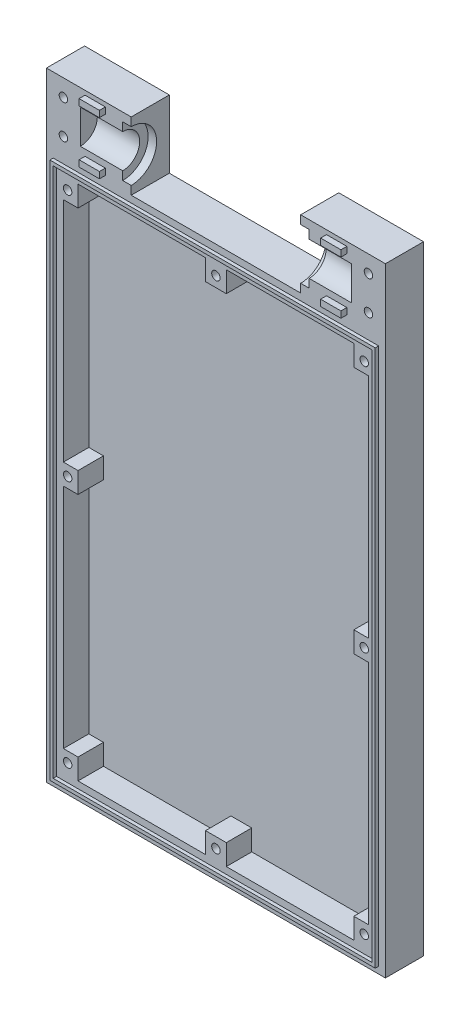
from build123d import *

# Parameters (mm, degrees)
IZIM1_R                       = 1
IZIM1_W                       = 4.8
IZIM1_H                       = 1.5
IZIM1_W_2                     = 76.8
IZIM1_H_2                     = 126.8
Y_KSEKLIK_EKSTR_ZYON1_DEPTH   = 9
IZIM1_W_3                     = 75.2
IZIM1_H_3                     = 125.2
Y_KSEKLIK_EKSTR_ZYON1_2_DEPTH = 9
IZIM1_3_W                     = 4.8
IZIM1_3_H                     = 1.5
Y_KSEKLIK_EKSTR_ZYON2_DEPTH   = 10.4
IZIM1_4_W                     = 76.8
IZIM1_4_H                     = 126.8
IZIM1_4_W_2                   = 75.2
IZIM1_4_H_2                   = 125.2
Y_KSEKLIK_EKSTR_ZYON3_DEPTH   = 9.8
Y_KSEKLIK_EKSTR_ZYON4_DEPTH   = 3
KES_EKSTR_ZYON1_DEPTH         = 52
KES_EKSTR_ZYON1_DEPTH_BACK    = 12
KES_EKSTR_ZYON2_DEPTH         = 42
KES_EKSTR_ZYON2_DEPTH_BACK    = 2


with BuildPart() as part:
    # Çizim1 → Yükseklik-Ekstrüzyon1 (new body)
    with BuildSketch(Plane.XY):
        Polygon((-33.05110417, 63.714698522), (-33.05110417, 79.714698522), (-53.05110417, 79.714698522), (-53.05110417, -66.285301478), (26.94889583, -66.285301478), (26.94889583, 79.714698522), (6.94889583, 79.714698522), (6.94889583, 63.714698522), align=None)
        with Locations((-49.05110417, 67.714698522)):
            Circle(IZIM1_R, mode=Mode.SUBTRACT)
        with Locations((-49.05110417, 75.714698522)):
            Circle(IZIM1_R, mode=Mode.SUBTRACT)
        with Locations((-41.55110417, 65.464698522)):
            Rectangle(IZIM1_W, IZIM1_H, mode=Mode.SUBTRACT)
        with Locations((-41.55110417, 77.964698522)):
            Rectangle(IZIM1_W, IZIM1_H, mode=Mode.SUBTRACT)
        with Locations((-13.05110417, -1.285301478)):
            Rectangle(IZIM1_W_2, IZIM1_H_2, mode=Mode.SUBTRACT)
        with Locations((22.94889583, 75.714698522)):
            Circle(IZIM1_R, mode=Mode.SUBTRACT)
        with Locations((15.44889583, 65.464698522)):
            Rectangle(IZIM1_W, IZIM1_H, mode=Mode.SUBTRACT)
        with Locations((15.44889583, 77.964698522)):
            Rectangle(IZIM1_W, IZIM1_H, mode=Mode.SUBTRACT)
        with Locations((22.94889583, 67.714698522)):
            Circle(IZIM1_R, mode=Mode.SUBTRACT)
    extrude(amount=Y_KSEKLIK_EKSTR_ZYON1_DEPTH)

    # Çizim1<3> → Yükseklik-Ekstrüzyon2 (add)
    with BuildSketch(Plane.XY):
        with Locations((15.44889583, 65.464698522)):
            Rectangle(IZIM1_3_W, IZIM1_3_H)
        with Locations((15.44889583, 77.964698522)):
            Rectangle(IZIM1_3_W, IZIM1_3_H)
        with Locations((-41.55110417, 77.964698522)):
            Rectangle(IZIM1_3_W, IZIM1_3_H)
        with Locations((-41.55110417, 65.464698522)):
            Rectangle(IZIM1_3_W, IZIM1_3_H)
    extrude(amount=Y_KSEKLIK_EKSTR_ZYON2_DEPTH)



with BuildPart() as body_2:
    # Çizim1 → Y_kseklik-Ekstr_zyon1 2 (new body)
    with BuildSketch(Plane.XY):
        with Locations((-13.05110417, -1.285301478)):
            Rectangle(IZIM1_W_3, IZIM1_H_3)
        with Locations((-48.05110417, -59.835301478)):
            Circle(IZIM1_R, mode=Mode.SUBTRACT)
        with Locations((-48.05110417, -1.285301478)):
            Circle(IZIM1_R, mode=Mode.SUBTRACT)
        with Locations((-13.05110417, -59.835301478)):
            Circle(IZIM1_R, mode=Mode.SUBTRACT)
        with Locations((21.94889583, -59.835301478)):
            Circle(IZIM1_R, mode=Mode.SUBTRACT)
        Polygon((-49.05110417, 54.814698522), (-45.60110417, 54.814698522), (-45.60110417, 59.714698522), (-15.50110417, 59.714698522), (-15.50110417, 54.814698522), (-10.60110417, 54.814698522), (-10.60110417, 59.714698522), (19.49889583, 59.714698522), (19.49889583, 54.814698522), (22.94889583, 54.814698522), (22.94889583, 1.164698522), (19.49889583, 1.164698522), (19.49889583, -3.735301478), (22.94889583, -3.766968147), (22.94889583, -57.385301478), (19.49889583, -57.385301478), (19.49889583, -62.285301478), (-10.60110417, -62.285301478), (-10.60110417, -57.385301478), (-15.50110417, -57.385301478), (-15.50110417, -62.285301478), (-45.60110417, -62.285301478), (-45.60110417, -57.385301478), (-49.05110417, -57.385301478), (-49.05110417, -3.735301478), (-45.60110417, -3.735301478), (-45.60110417, 1.164698522), (-49.05110417, 1.164698522), align=None, mode=Mode.SUBTRACT)
        with Locations((21.94889583, -1.285301478)):
            Circle(IZIM1_R, mode=Mode.SUBTRACT)
        with Locations((-48.05110417, 57.264698522)):
            Circle(IZIM1_R, mode=Mode.SUBTRACT)
        with Locations((-13.05110417, 57.264698522)):
            Circle(IZIM1_R, mode=Mode.SUBTRACT)
        with Locations((21.94889583, 57.264698522)):
            Circle(IZIM1_R, mode=Mode.SUBTRACT)
    extrude(amount=Y_KSEKLIK_EKSTR_ZYON1_2_DEPTH)


with BuildPart() as part_1:
    add(part.part)

    add(body_2.part)  # Yükseklik-Ekstrüzyon3 merges body 2
    # Çizim1<4> → Yükseklik-Ekstrüzyon3 (add)
    with BuildSketch(Plane.XY):
        with Locations((-13.05110417, -1.285301478)):
            Rectangle(IZIM1_4_W, IZIM1_4_H)
        with Locations((-13.05110417, -1.285301478)):
            Rectangle(IZIM1_4_W_2, IZIM1_4_H_2, mode=Mode.SUBTRACT)
    extrude(amount=Y_KSEKLIK_EKSTR_ZYON3_DEPTH)

    # Çizim1<5> → Yükseklik-Ekstrüzyon4 (add)
    with BuildSketch(Plane.XY):
        Polygon((-45.60110417, 59.714698522), (-45.60110417, 54.814698522), (-49.05110417, 54.814698522), (-49.05110417, 1.164698522), (-45.60110417, 1.164698522), (-45.60110417, -3.735301478), (-49.05110417, -3.735301478), (-49.05110417, -57.385301478), (-45.60110417, -57.385301478), (-45.60110417, -62.285301478), (-15.50110417, -62.285301478), (-15.50110417, -57.385301478), (-10.60110417, -57.385301478), (-10.60110417, -62.285301478), (19.49889583, -62.285301478), (19.49889583, -57.385301478), (22.94889583, -57.385301478), (22.94889583, -3.766968147), (19.49889583, -3.735301478), (19.49889583, 1.164698522), (22.94889583, 1.164698522), (22.94889583, 54.814698522), (19.49889583, 54.814698522), (19.49889583, 59.714698522), (-10.60110417, 59.714698522), (-10.60110417, 54.814698522), (-15.50110417, 54.814698522), (-15.50110417, 59.714698522), align=None)
    extrude(amount=Y_KSEKLIK_EKSTR_ZYON4_DEPTH)

    # Çizim2 → Kes-Ekstrüzyon1 (cut, two sides: drawn at the far end of the back side and taken through both)
    with BuildSketch(Plane.ZY.offset(-6.94889583).offset(-KES_EKSTR_ZYON1_DEPTH_BACK)):
        with BuildLine():
            Line((9, 67.714698522), (9, 75.714698522))
            ThreePointArc((9, 75.714698522), (5, 71.714698522), (9, 67.714698522))
        make_face()
    extrude(amount=KES_EKSTR_ZYON1_DEPTH + KES_EKSTR_ZYON1_DEPTH_BACK, mode=Mode.SUBTRACT)

    # Çizim2<3> → Kes-Ekstrüzyon2 (cut, two sides: drawn at the far end of the back side and taken through both)
    with BuildSketch(Plane.ZY.offset(-6.94889583).offset(-KES_EKSTR_ZYON2_DEPTH_BACK)):
        with BuildLine():
            Line((9, 75.714698522), (9, 77.714698522))
            ThreePointArc((9, 77.714698522), (3, 71.714698522), (9, 65.714698522))
            Line((9, 65.714698522), (9, 67.714698522))
            ThreePointArc((9, 67.714698522), (5, 71.714698522), (9, 75.714698522))
        make_face()
    extrude(amount=KES_EKSTR_ZYON2_DEPTH + KES_EKSTR_ZYON2_DEPTH_BACK, mode=Mode.SUBTRACT)


solid = part_1.part
